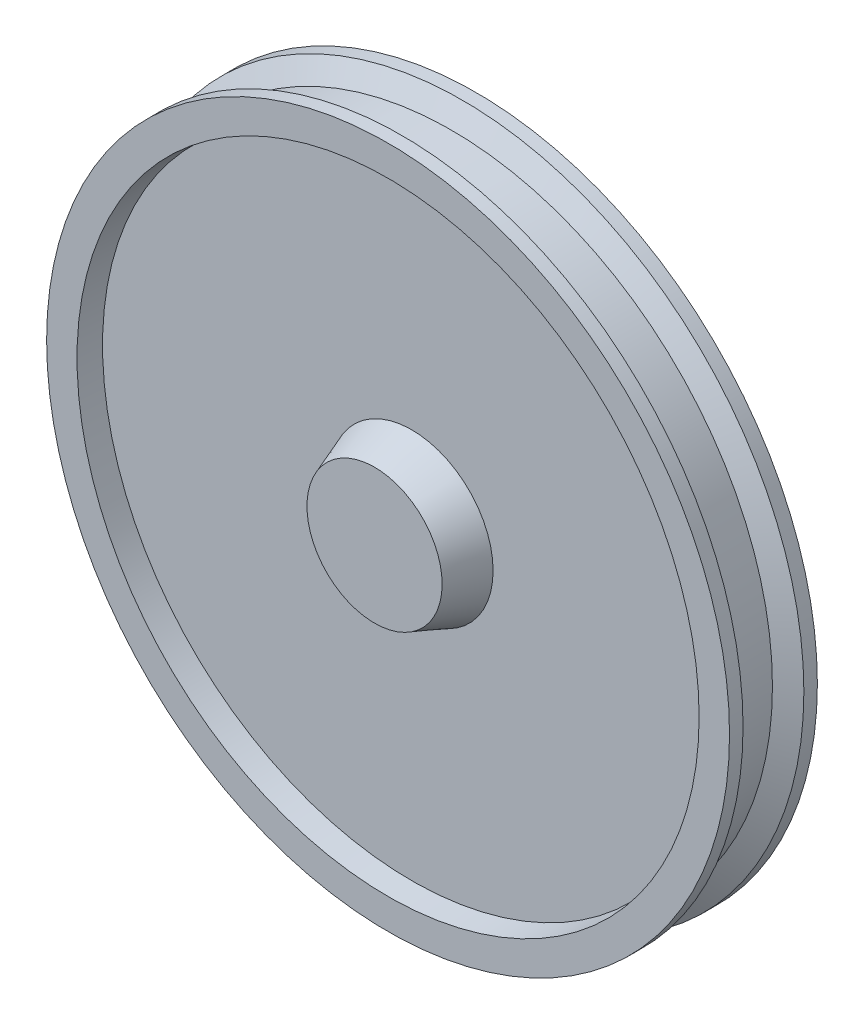
from build123d import *


with BuildPart() as part:
    # Sketch1 → Revolve1 (revolve)
    with BuildSketch(Plane(origin=(0, 0, 0), x_dir=(0, 0, -1), z_dir=(1, 0, 0)), mode=Mode.PRIVATE) as revolve1_sk:
        Polygon((-85, 0), (-85, 100), (-30, 120.407271829), (-30, 457.5), (-65, 460.254556655), (-65, 505.254556655), (-45, 505.254556655), (-28.508256592, 475.254556655), (28.508256592, 475.254556655), (45, 505.254556655), (65, 505.254556655), (65, 460.254556655), (30, 457.5), (30, 120.407271829), (85, 100), (85, 0), align=None)
    revolve(revolve1_sk.sketch.rotate(Axis((0, 0, 374.636327729), (0, 0, -1)), 90), axis=Axis((0, 0, 374.636327729), (0, 0, -1)))


solid = part.part
